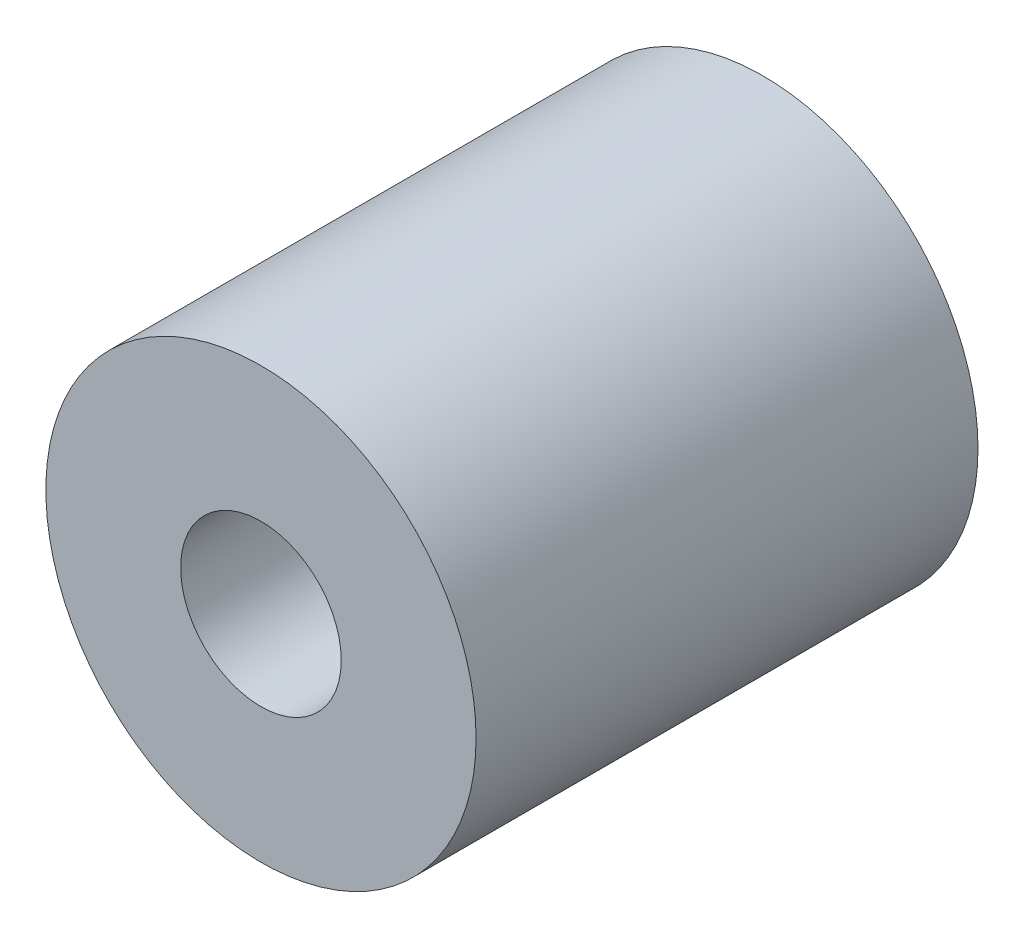
from build123d import *

# Parameters (mm, degrees)
SKETCH1_R      = 4.7625
SKETCH1_R_2    = 1.778
EXTRUDE1_DEPTH = 5.55625


with BuildPart() as part:
    # Sketch1 → Extrude1 (new, symmetric)
    with BuildSketch(Plane.XY):
        Circle(SKETCH1_R)
        Circle(SKETCH1_R_2, mode=Mode.SUBTRACT)
    extrude(amount=EXTRUDE1_DEPTH, both=True)


solid = part.part
